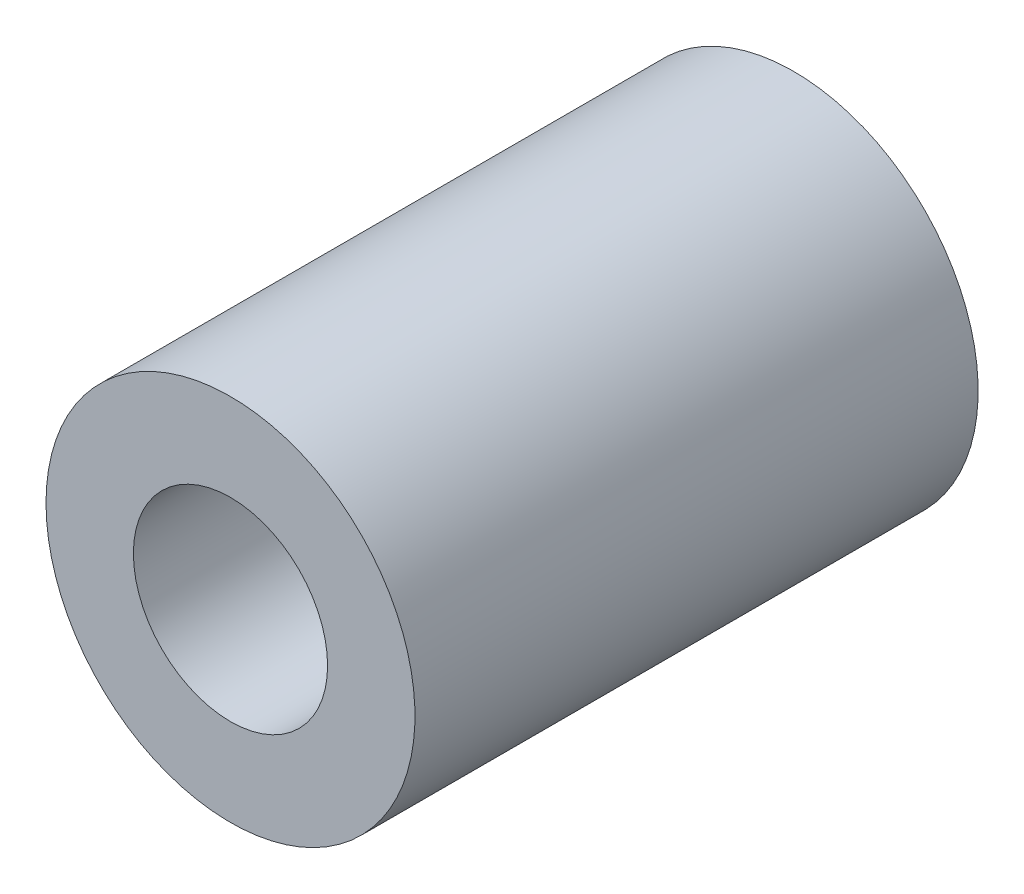
from build123d import *

# Parameters (mm, degrees)
SKETCH_1_R      = 9.5
SKETCH_1_R_2    = 5
EXTRUDE_1_DEPTH = 29


with BuildPart() as part:
    # 草图1 → 凸台-拉伸1 (new body)
    with BuildSketch(Plane.XY):
        with Locations(Location((0, 0, 0), (0, 0, 180))):
            Circle(SKETCH_1_R)
        with Locations(Location((0, 0, 0), (0, 0, 180))):
            Circle(SKETCH_1_R_2, mode=Mode.SUBTRACT)
    extrude(amount=EXTRUDE_1_DEPTH)


solid = part.part
